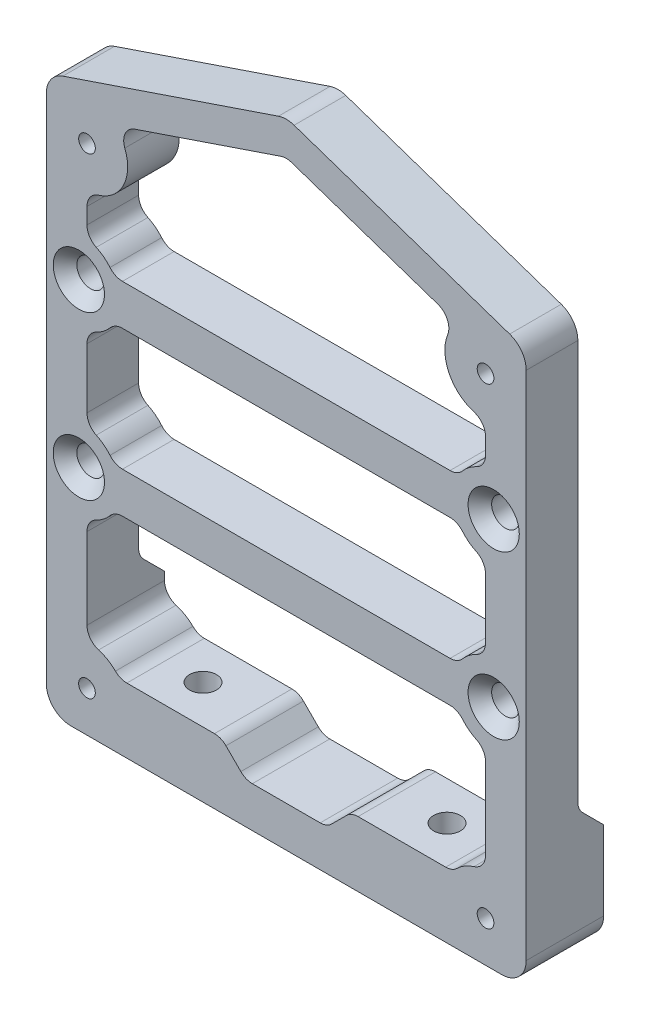
from build123d import *

# Parameters (mm, degrees)
BOSS_EXTRUDE1_DEPTH                             = 4.7625
CUT_EXTRUDE1_DEPTH                              = 98.916706472
FILLET1_R                                       = 3
M2_5X0_45_TAPPED_HOLE1_D                        = 2.05
M4X0_7_TAPPED_HOLE1_D                           = 3.3
M4X0_7_TAPPED_HOLE1_DEPTH                       = 11.5
M4X0_7_TAPPED_HOLE1_TIP                         = 0.991420021
CSK_FOR_M3_FLAT_HEAD_MACHINE_SCREW1_D           = 3.4
CSK_FOR_M3_FLAT_HEAD_MACHINE_SCREW1_CSINK_D     = 6.3
CSK_FOR_M3_FLAT_HEAD_MACHINE_SCREW1_CSINK_ANGLE = 90
CUT_EXTRUDE2_DEPTH                              = 84.778552935
FILLET2_R                                       = 2


with BuildPart() as part:
    # Sketch1 → Boss-Extrude1 (new, symmetric)
    with BuildSketch(Plane.XY):
        Polygon((-29.5, 68), (0, 78), (29.5, 68), (29.5, 0), (-29.5, 0), align=None)
    extrude(amount=BOSS_EXTRUDE1_DEPTH, both=True)

    # Sketch2 → Cut-Extrude1 (cut, through all)
    with BuildSketch(Plane(origin=(29.5, 0, 0), x_dir=(0, 0, -1), z_dir=(1, 0, 0))):
        Polygon((1.5875, 78), (1.5875, 15.875), (4.7625, 12.7), (4.7625, 78), align=None)
    extrude(amount=-CUT_EXTRUDE1_DEPTH, mode=Mode.SUBTRACT)

    # Fillet1
    fillet1_edges = [part.edges().sort_by_distance(p)[0] for p in [
        (0, 78, 1.5875),
        (29.5, 68, 1.5875),
        (29.5, 0, 0),
        (-29.5, 0, 0),
        (-29.5, 68, 1.5875),
    ]]
    fillet(fillet1_edges, radius=FILLET1_R)

    # M2.5x0.45 Tapped Hole1 (through all)
    with Locations(Plane.XY.offset(4.7625)):
        with Locations((-24.5, 5), (24.5, 5), (-24.5, 63), (24.5, 63)):
            Hole(M2_5X0_45_TAPPED_HOLE1_D / 2)

    # M4x0.7 Tapped Hole1
    with Locations(Plane(origin=(0, 0, 0), x_dir=(-1, 0, 0), z_dir=(0, -1, 0))):
        with Locations((-15, 0), (15, 0)):
            Hole(M4X0_7_TAPPED_HOLE1_D / 2, depth=M4X0_7_TAPPED_HOLE1_DEPTH)
            with Locations((0, 0, -(M4X0_7_TAPPED_HOLE1_DEPTH + M4X0_7_TAPPED_HOLE1_TIP / 2))):  # 118° drill point
                Cone(0, M4X0_7_TAPPED_HOLE1_D / 2, M4X0_7_TAPPED_HOLE1_TIP, mode=Mode.SUBTRACT)

    # CSK for M3 Flat Head Machine Screw1 (through all)
    with Locations(Plane.XY.offset(4.7625)):
        with Locations((-25.5, 28), (25.5, 28), (-25.5, 48), (25.5, 48)):
            CounterSinkHole(CSK_FOR_M3_FLAT_HEAD_MACHINE_SCREW1_D / 2, CSK_FOR_M3_FLAT_HEAD_MACHINE_SCREW1_CSINK_D / 2, counter_sink_angle=CSK_FOR_M3_FLAT_HEAD_MACHINE_SCREW1_CSINK_ANGLE)

    # Sketch7 → Cut-Extrude2 (cut, through all)
    with BuildSketch(Plane.XY.offset(4.7625)):
        with BuildLine():
            Line((-24.5, 43.101020514), (-24.5, 32.898979486))
            ThreePointArc((-24.5, 32.898979486), (-22.577443045, 32.056927513), (-21.169872981, 30.5))
            Line((-21.169872981, 30.5), (21.169872981, 30.5))
            ThreePointArc((21.169872981, 30.5), (22.577443045, 32.056927513), (24.5, 32.898979486))
            Line((24.5, 32.898979486), (24.5, 43.101020514))
            ThreePointArc((24.5, 43.101020514), (22.577443045, 43.943072487), (21.169872981, 45.5))
            Line((21.169872981, 45.5), (-21.169872981, 45.5))
            ThreePointArc((-21.169872981, 45.5), (-22.577443045, 43.943072487), (-24.5, 43.101020514))
        make_face()
        with BuildLine():
            ThreePointArc((-21.169872981, 25.5), (-22.577443045, 23.943072487), (-24.5, 23.101020514))
            Line((-24.5, 23.101020514), (-24.5, 10))
            ThreePointArc((-24.5, 10), (-22.263932023, 9.472135955), (-20.5, 8))
            Line((-20.5, 8), (-8, 8))
            Line((-8, 8), (-5, 5))
            Line((-5, 5), (5, 5))
            Line((5, 5), (8, 8))
            Line((8, 8), (20.5, 8))
            ThreePointArc((20.5, 8), (22.263932023, 9.472135955), (24.5, 10))
            Line((24.5, 10), (24.5, 23.101020514))
            ThreePointArc((24.5, 23.101020514), (22.577443045, 23.943072487), (21.169872981, 25.5))
            Line((21.169872981, 25.5), (-21.169872981, 25.5))
        make_face()
        with BuildLine():
            Line((-24.5, 58), (-24.5, 52.898979486))
            ThreePointArc((-24.5, 52.898979486), (-22.577443045, 52.056927513), (-21.169872981, 50.5))
            Line((-21.169872981, 50.5), (21.169872981, 50.5))
            ThreePointArc((21.169872981, 50.5), (22.577443045, 52.056927513), (24.5, 52.898979486))
            Line((24.5, 52.898979486), (24.5, 58))
            ThreePointArc((24.5, 58), (19.853737933, 61.15277267), (21.066919092, 66.635100477))
            Line((21.066919092, 66.635100477), (0, 73.776428982))
            Line((0, 73.776428982), (-21.066919092, 66.635100477))
            ThreePointArc((-21.066919092, 66.635100477), (-19.853737933, 61.15277267), (-24.5, 58))
        make_face()
    extrude(amount=-CUT_EXTRUDE2_DEPTH, mode=Mode.SUBTRACT)

    # Fillet2
    fillet2_edges = [part.edges().sort_by_distance(p)[0] for p in [
        (27, 15.875, -1.5875),
        (21.169872981, 50.5, 1.5875),
        (-21.169872981, 50.5, 1.5875),
        (-24.5, 52.898979486, 1.5875),
        (-24.5, 58, 1.5875),
        (-21.066919092, 66.635100477, 1.5875),
        (0, 73.776428982, 1.5875),
        (21.066919092, 66.635100477, 1.5875),
        (24.5, 58, 1.5875),
        (24.5, 52.898979486, 1.5875),
        (24.5, 43.101020514, 1.5875),
        (24.5, 32.898979486, 1.5875),
        (21.169872981, 30.5, 1.5875),
        (-21.169872981, 30.5, 1.5875),
        (-24.5, 32.898979486, 1.5875),
        (-24.5, 43.101020514, 1.5875),
        (-21.169872981, 45.5, 1.5875),
        (21.169872981, 45.5, 1.5875),
        (-24.5, 23.101020514, 1.5875),
        (-21.169872981, 25.5, 1.5875),
        (21.169872981, 25.5, 1.5875),
        (24.5, 23.101020514, 1.5875),
        (-24.5, 10, 0),
        (-8, 8, 0),
        (20.5, 8, 0),
        (24.5, 10, 0),
        (8, 8, 0),
        (5, 5, 0),
        (-5, 5, 0),
        (-20.5, 8, 0),
        (-27, 15.875, -1.5875),
    ]]
    fillet(fillet2_edges, radius=FILLET2_R)


solid = part.part
